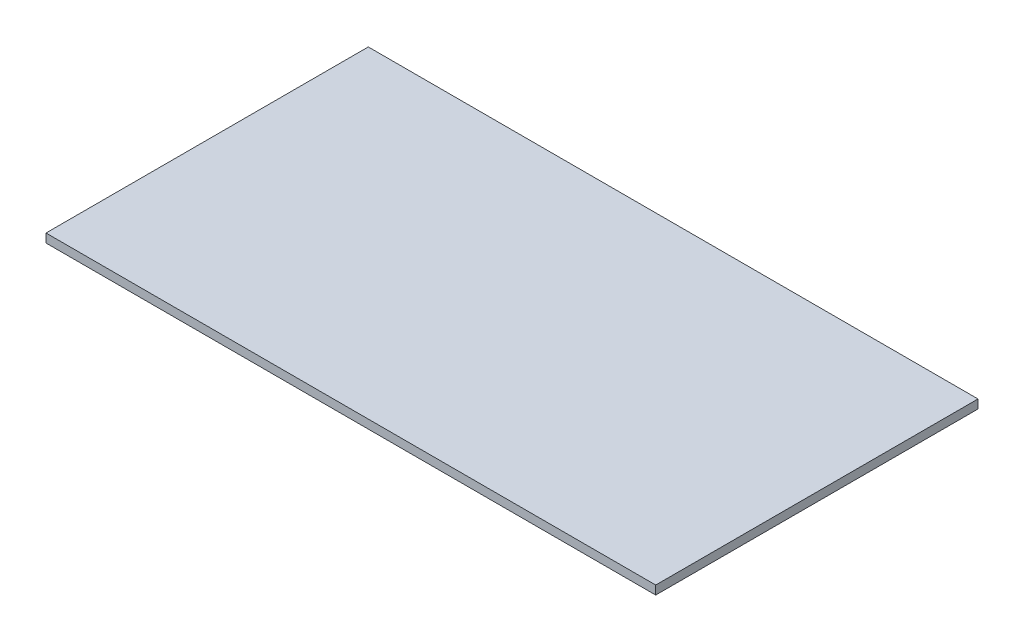
from build123d import *

# Parameters (mm, degrees)
SKETCH1_W           = 350
SKETCH1_H           = 185
BOSS_EXTRUDE1_DEPTH = 5


with BuildPart() as part:
    # Sketch1 → Boss-Extrude1 (new body)
    with BuildSketch(Plane(origin=(0, 0, 0), x_dir=(1, 0, 0), z_dir=(0, 1, 0))):
        Rectangle(SKETCH1_W, SKETCH1_H)
    extrude(amount=BOSS_EXTRUDE1_DEPTH)


solid = part.part
